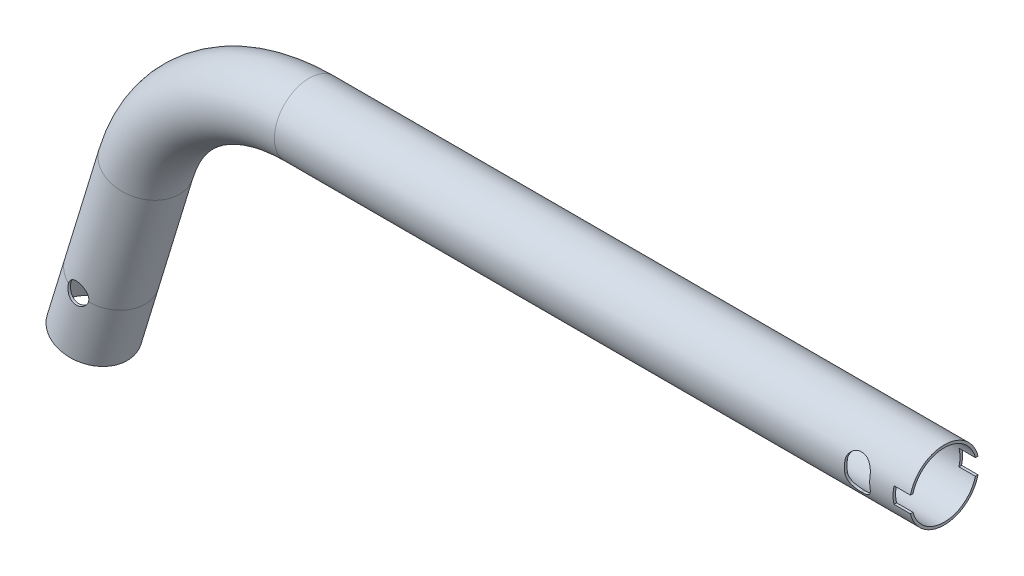
from build123d import *

# Parameters (mm, degrees)
SKETCH3_R          = 11
SKETCH3_R_2        = 10.2
CUT_EXTRUDE1_REACH = 197.895
SKETCH4_R          = 3.3
SKETCH5_R          = 3.3
CUT_EXTRUDE2_DEPTH = 196.894862351
SKETCH6_W          = 5.2
SKETCH6_H          = 5.111091306
CUT_EXTRUDE3_DEPTH = 196.894862351


with BuildPart() as part:
    # Sweep2: sweep along a path in Sketch1
    with BuildLine(Plane.XY) as sweep2_path:
        Line((108.839588828, 0), (92.239588828, 0))
        Line((92.239588828, 0), (-92.239588828, 0))
        ThreePointArc((-92.239588828, 0), (-124.360019313, -10.591729527), (-143.88004565, -38.211927945))
        Line((-143.88004565, -38.211927945), (-154.760411172, -73.8))
        Line((-154.760411172, -73.8), (-160.324709574, -92))
    # Sketch3 → Sweep2 (sweep)
    with BuildSketch(Plane(origin=(92.239588828, 0, 0), x_dir=(0, 0, -1), z_dir=(1, 0, 0))):
        Circle(SKETCH3_R)
        Circle(SKETCH3_R_2, mode=Mode.SUBTRACT)
    sweep(path=sweep2_path.line)

    # Sketch4 → Cut-Extrude1 (cut, up to next)
    with BuildSketch(Plane.XY, mode=Mode.PRIVATE) as cut_extrude1_sk1:
        with Locations((-154.760411172, -73.8)):
            Circle(SKETCH4_R)
    cut_extrude1_tool1 = extrude(cut_extrude1_sk1.sketch, amount=CUT_EXTRUDE1_REACH, mode=Mode.PRIVATE) & part.part
    # Sketch4 → Cut-Extrude1 (cut, up to next)
    with BuildSketch(Plane.XY, mode=Mode.PRIVATE) as cut_extrude1_sk2:
        Polygon((108.839588828, 2.555545653), (108.839588828, -2.555545653), (105.639588828, -2.555545653), (103.639588828, -2.555545653), (103.639588828, -0.555545653), (103.639588828, 0.555545653), (103.639588828, 2.555545653), (105.639588828, 2.555545653), align=None)
    cut_extrude1_tool2 = extrude(cut_extrude1_sk2.sketch, amount=CUT_EXTRUDE1_REACH, mode=Mode.PRIVATE) & part.part
    # Sketch4 → Cut-Extrude1 (cut, up to next)
    with BuildSketch(Plane.XY, mode=Mode.PRIVATE) as cut_extrude1_sk3:
        with BuildLine():
            Line((91.989588828, -5.5), (92.489588828, -5.5))
            ThreePointArc((92.489588828, -5.5), (95.141239258, -4.401650429), (96.239588828, -1.75))
            Line((96.239588828, -1.75), (96.239588828, 1.75))
            ThreePointArc((96.239588828, 1.75), (95.141239258, 4.401650429), (92.489588828, 5.5))
            Line((92.489588828, 5.5), (91.989588828, 5.5))
            ThreePointArc((91.989588828, 5.5), (89.337938399, 4.401650429), (88.239588828, 1.75))
            Line((88.239588828, 1.75), (88.239588828, -1.75))
            ThreePointArc((88.239588828, -1.75), (89.337938399, -4.401650429), (91.989588828, -5.5))
        make_face()
    cut_extrude1_tool3 = extrude(cut_extrude1_sk3.sketch, amount=CUT_EXTRUDE1_REACH, mode=Mode.PRIVATE) & part.part
    add(cut_extrude1_tool1.solids().sort_by_distance((-154.760411, -73.8, 0))[0], mode=Mode.SUBTRACT)
    add(cut_extrude1_tool2.solids().sort_by_distance((106.239589, 0, 0))[0], mode=Mode.SUBTRACT)
    add(cut_extrude1_tool3.solids().sort_by_distance((92.239589, 0, 0))[0], mode=Mode.SUBTRACT)

    # Sketch5 → Cut-Extrude2 (cut, through all)
    with BuildSketch(Plane.XY):
        with Locations((-154.760411172, -73.8)):
            Circle(SKETCH5_R)
    extrude(amount=-CUT_EXTRUDE2_DEPTH, mode=Mode.SUBTRACT)

    # Sketch6 → Cut-Extrude3 (cut, through all)
    with BuildSketch(Plane.XY):
        with Locations((106.239588828, 0)):
            Rectangle(SKETCH6_W, SKETCH6_H)
    extrude(amount=-CUT_EXTRUDE3_DEPTH, mode=Mode.SUBTRACT)


solid = part.part
